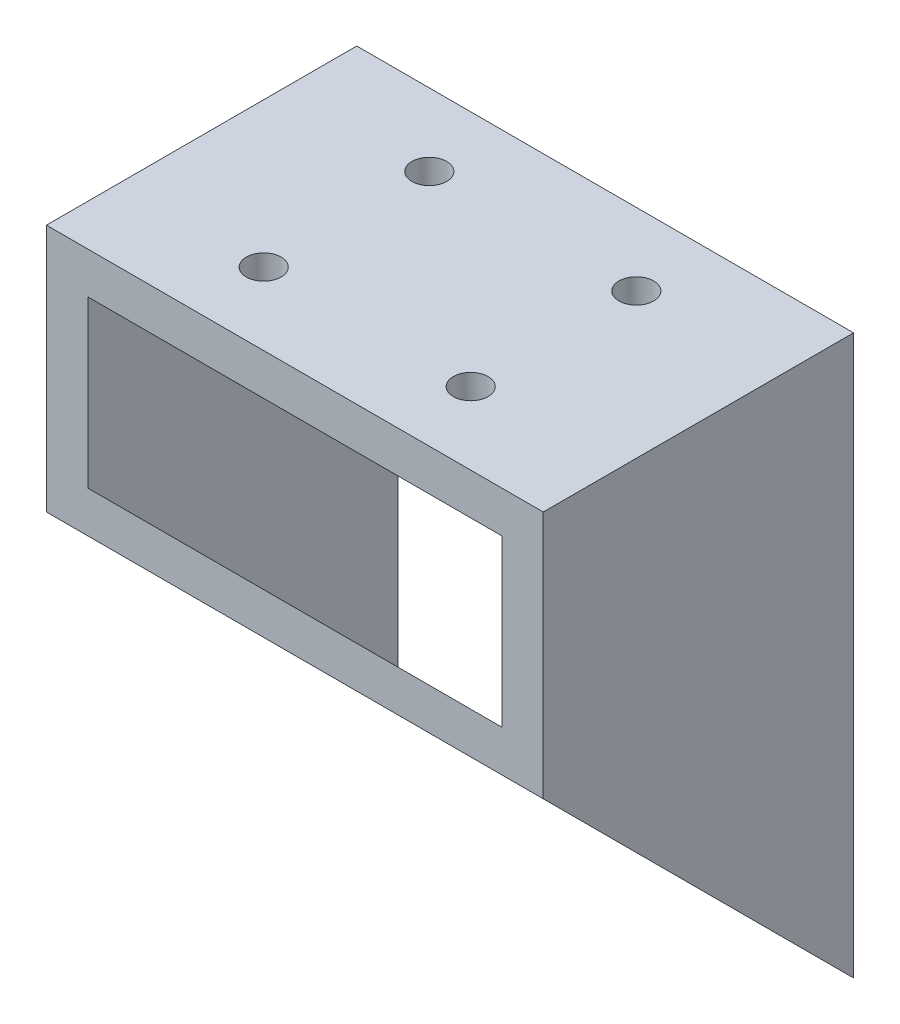
from build123d import *

# Parameters (mm, degrees)
EXTRUDE_1_DEPTH     = 5
EXTRUDE_3_DEPTH     = 50
CUT_EXTRUDE_2_DEPTH = 50
EXTRUDE_4_DEPTH     = 5
SKETCH_6_W          = 60
SKETCH_6_H          = 37.476659403
EXTRUDE_5_DEPTH     = 5
SKETCH_7_R          = 2.1
CUT_EXTRUDE_3_DEPTH = 5


with BuildPart() as part:
    # 草图2 → 凸台-拉伸1 (new body)
    with BuildSketch(Plane(origin=(0, 0, 0), x_dir=(0, 0, -1), z_dir=(1, 0, 0))):
        Polygon((0, 30), (0, 0), (37.476659403, -37.476659403), (37.476659403, 30), align=None)
    extrude(amount=EXTRUDE_1_DEPTH)

    # 草图4 → 凸台-拉伸3 (add)
    with BuildSketch(Plane(origin=(5, 0, 0), x_dir=(0, 0, -1), z_dir=(1, 0, 0))):
        Polygon((0, 0), (0, 5), (37.476659403, -32.476659403), (37.476659403, -37.476659403), align=None)
    extrude(amount=EXTRUDE_3_DEPTH)

    # 草图3 → 切除-拉伸2 (cut)
    with BuildSketch(Plane(origin=(0, 0, 0), x_dir=(1, 0, 0), z_dir=(0, -0.7071067811865489, 0.7071067811865462))):
        with BuildLine():
            ThreePointArc((17.1, -41), (15, -43.1), (12.9, -41))
            Line((12.9, -41), (12.9, -11))
            ThreePointArc((12.9, -11), (15, -8.9), (17.1, -11))
            Line((17.1, -11), (17.1, -41))
        make_face()
        with BuildLine():
            Line((42.9, -11), (42.9, -41))
            ThreePointArc((42.9, -41), (45, -43.1), (47.1, -41))
            Line((47.1, -41), (47.1, -11))
            ThreePointArc((47.1, -11), (45, -8.9), (42.9, -11))
        make_face()
    extrude(amount=-CUT_EXTRUDE_2_DEPTH, mode=Mode.SUBTRACT)

    # 草图5 → 凸台-拉伸4 (add)
    with BuildSketch(Plane(origin=(55, 0, 0), x_dir=(0, 0, -1), z_dir=(1, 0, 0))):
        Polygon((0, 30), (0, 0), (37.476659403, -37.476659403), (37.476659403, 30), align=None)
    extrude(amount=EXTRUDE_4_DEPTH)

    # 草图6 → 凸台-拉伸5 (add)
    with BuildSketch(Plane(origin=(0, 30, 0), x_dir=(1, 0, 0), z_dir=(0, 1, 0))):
        with Locations((30, 18.738329701)):
            Rectangle(SKETCH_6_W, SKETCH_6_H)
    extrude(amount=-EXTRUDE_5_DEPTH)

    # 草图7 → 切除-拉伸3 (cut)
    with BuildSketch(Plane(origin=(0, 30, 0), x_dir=(1, 0, 0), z_dir=(0, 1, 0))):
        with Locations(Location((42.5, 28.738329701, 0), (0, 0, 270))):
            Circle(SKETCH_7_R)
        with Locations(Location((17.5, 28.738329701, 0), (0, 0, 90))):
            Circle(SKETCH_7_R)
        with Locations(Location((42.5, 8.738329701, 0), (0, 0, 90))):
            Circle(SKETCH_7_R)
        with Locations(Location((17.5, 8.738329701, 0), (0, 0, 270))):
            Circle(SKETCH_7_R)
    extrude(amount=-CUT_EXTRUDE_3_DEPTH, mode=Mode.SUBTRACT)


solid = part.part
